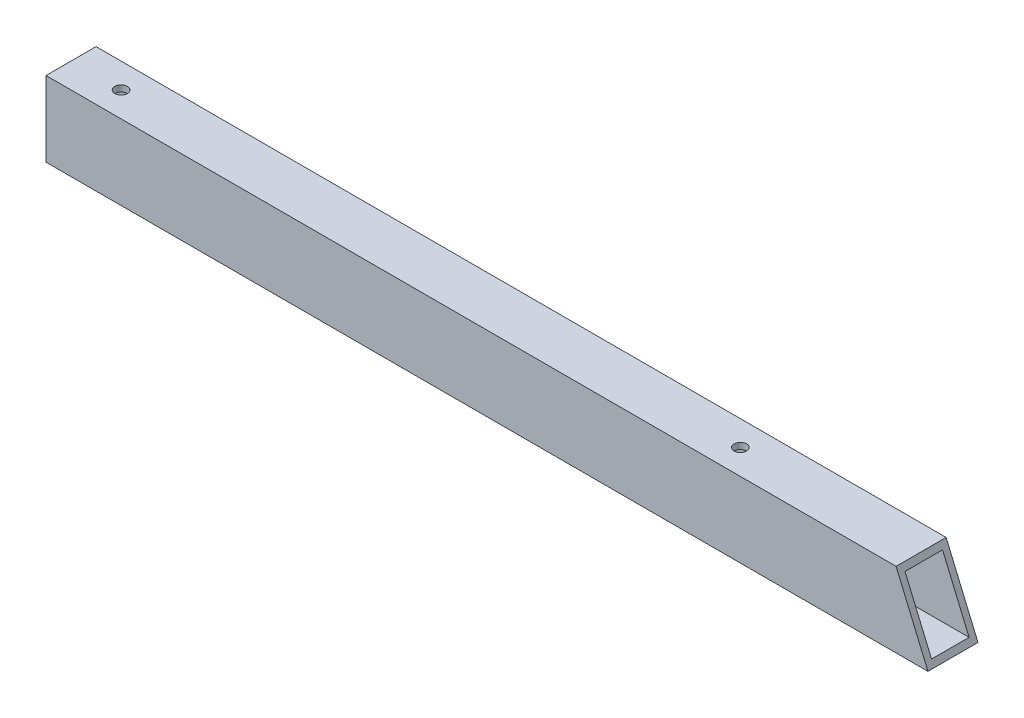
from build123d import *

# Parameters (mm, degrees)
SKETCH1_W                 = 25.4
SKETCH1_H                 = 38.1
SKETCH1_W_2               = 19.05
SKETCH1_H_2               = 31.75
BEAM_DEPTH                = 447.675
MITER_CUT_DEPTH           = 449.799474292
SKETCH4_R                 = 3.175
BOLT_CLEARANCE_HOLE_DEPTH = 450.472808549
SKETCH5_R                 = 6.35
CLEARANCE_HOLE_DEPTH      = 12.7


with BuildPart() as part:
    # Sketch1 → beam (new body)
    with BuildSketch(Plane(origin=(0, 0, 0), x_dir=(0, 0, -1), z_dir=(1, 0, 0))):
        Rectangle(SKETCH1_W, SKETCH1_H)
        Rectangle(SKETCH1_W_2, SKETCH1_H_2, mode=Mode.SUBTRACT)
    extrude(amount=-BEAM_DEPTH)

    # Sketch2 → miter cut (cut, through all)
    with BuildSketch(Plane.XY.offset(12.7)):
        Polygon((0, -19.05), (-16.172490498, 19.05), (0, 19.05), align=None)
    extrude(amount=-MITER_CUT_DEPTH, mode=Mode.SUBTRACT)

    # Sketch4 → bolt clearance hole (cut, through all)
    with BuildSketch(Plane(origin=(0, 19.05, 0), x_dir=(1, 0, 0), z_dir=(0, 1, 0))):
        with Locations(Location((-422.275, 0, 0), (0, 0, 270))):
            Circle(SKETCH4_R)
        with Locations(Location((-107.95, 0, 0), (0, 0, 270))):
            Circle(SKETCH4_R)
    extrude(amount=-BOLT_CLEARANCE_HOLE_DEPTH, mode=Mode.SUBTRACT)

    # Sketch5 → clearance hole (cut)
    with BuildSketch(Plane.XZ.offset(19.05)):
        with Locations(Location((-422.275, 0, 0), (0, 0, 270))):
            Circle(SKETCH5_R)
        with Locations(Location((-107.95, 0, 0), (0, 0, 270))):
            Circle(SKETCH5_R)
    extrude(amount=-CLEARANCE_HOLE_DEPTH, mode=Mode.SUBTRACT)


solid = part.part
